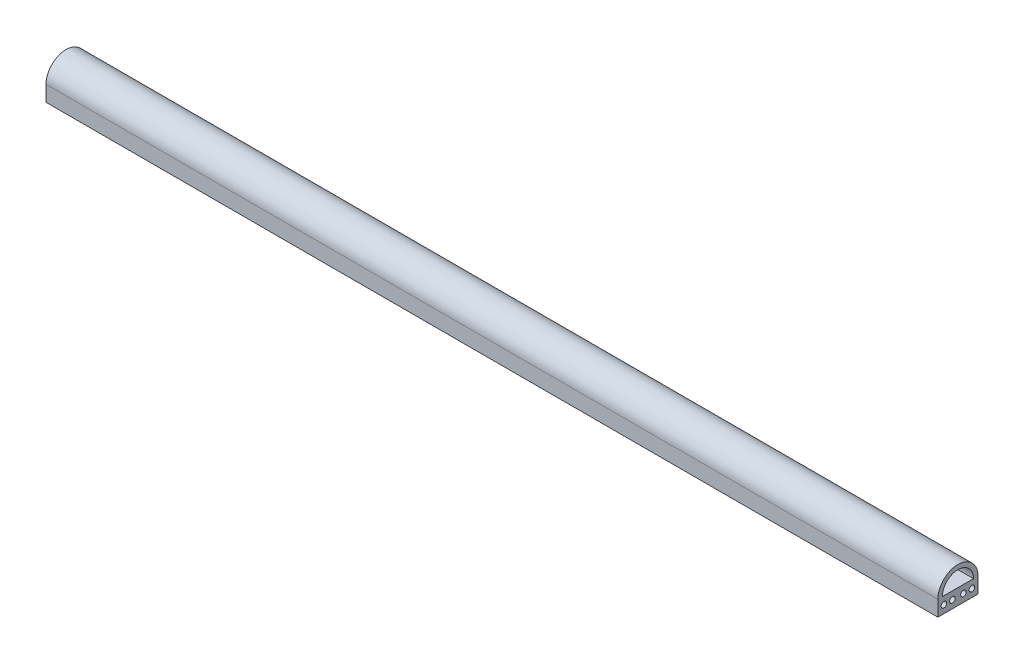
from build123d import *

# Parameters (mm, degrees)
EXTRUDE_4_DEPTH      = 100
EXTRUDE_4_DEPTH_BACK = 100
SKETCH_1_4_R         = 0.625


with BuildPart() as part:
    # 草图1<4> → 凸台-拉伸4 (new, two sides: drawn at the far end of the back side and taken through both)
    with BuildSketch(Plane(origin=(0, 0, 0), x_dir=(0, 0, -1), z_dir=(1, 0, 0)).offset(-EXTRUDE_4_DEPTH_BACK)):
        with BuildLine():
            Line((-4.5, 0), (0, 0))
            Line((0, 0), (4.5, 0))
            Line((4.5, 0), (4.5, 3.5))
            ThreePointArc((4.5, 3.5), (0, 8), (-4.5, 3.5))
            Line((-4.5, 3.5), (-4.5, 0))
        make_face()
        with Locations((-3.134058813, 1.75)):
            Circle(SKETCH_1_4_R, mode=Mode.SUBTRACT)
        with Locations((-1.224833948, 1.75)):
            Circle(SKETCH_1_4_R, mode=Mode.SUBTRACT)
        with Locations((1.224833948, 1.75)):
            Circle(SKETCH_1_4_R, mode=Mode.SUBTRACT)
        with Locations((3.134058813, 1.75)):
            Circle(SKETCH_1_4_R, mode=Mode.SUBTRACT)
        with BuildLine():
            Line((3.490727195, 3.5), (-3.490727195, 3.5))
            ThreePointArc((-3.490727195, 3.5), (0, 6.990727195), (3.490727195, 3.5))
        make_face(mode=Mode.SUBTRACT)
    extrude(amount=EXTRUDE_4_DEPTH + EXTRUDE_4_DEPTH_BACK)


solid = part.part
